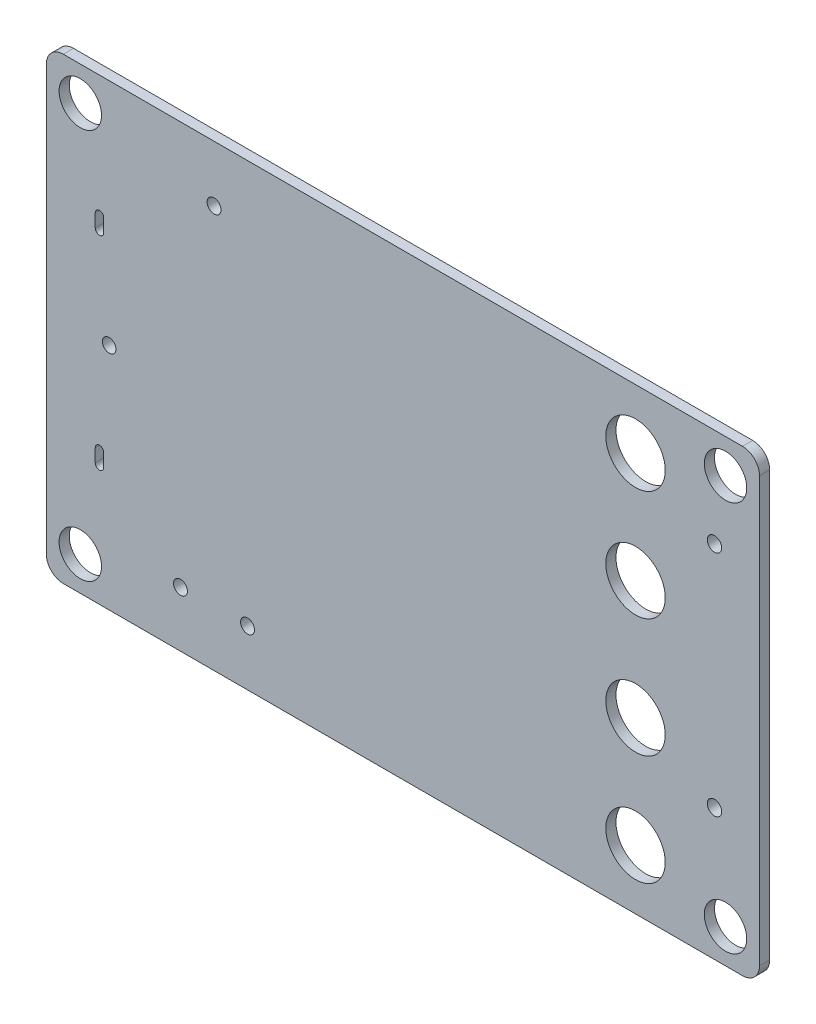
from build123d import *

# Parameters (mm, degrees)
SKETCH1_W           = 106.68
SKETCH1_H           = 68.58
BOSS_EXTRUDE1_DEPTH = 1.524
CUT_EXTRUDE1_REACH  = 65.429
SKETCH2_R           = 3.175
CUT_EXTRUDE2_REACH  = 65.429
SKETCH3_R           = 4.445
FILLET1_R           = 2.54
CUT_EXTRUDE3_REACH  = 65.429
SKETCH4_R           = 1.0414
SKETCH4_R_2         = 1.0795
CUT_EXTRUDE4_REACH  = 65.429
SKETCH5_R           = 1.016
CUT_EXTRUDE5_REACH  = 65.429


with BuildPart() as part:
    # Sketch1 → Boss-Extrude1 (new body)
    with BuildSketch(Plane.XY):
        Rectangle(SKETCH1_W, SKETCH1_H)
    extrude(amount=BOSS_EXTRUDE1_DEPTH)

    # Sketch2 → Cut-Extrude1 (cut, up to next)
    with BuildSketch(Plane.XY.offset(1.524), mode=Mode.PRIVATE) as cut_extrude1_sk1:
        with Locations((-48.26, 29.21)):
            Circle(SKETCH2_R)
    cut_extrude1_tool1 = extrude(cut_extrude1_sk1.sketch, amount=-CUT_EXTRUDE1_REACH, mode=Mode.PRIVATE) & part.part
    # Sketch2 → Cut-Extrude1 (cut, up to next)
    with BuildSketch(Plane.XY.offset(1.524), mode=Mode.PRIVATE) as cut_extrude1_sk2:
        with Locations((-48.26, -29.21)):
            Circle(SKETCH2_R)
    cut_extrude1_tool2 = extrude(cut_extrude1_sk2.sketch, amount=-CUT_EXTRUDE1_REACH, mode=Mode.PRIVATE) & part.part
    # Sketch2 → Cut-Extrude1 (cut, up to next)
    with BuildSketch(Plane.XY.offset(1.524), mode=Mode.PRIVATE) as cut_extrude1_sk3:
        with Locations((48.26, -29.21)):
            Circle(SKETCH2_R)
    cut_extrude1_tool3 = extrude(cut_extrude1_sk3.sketch, amount=-CUT_EXTRUDE1_REACH, mode=Mode.PRIVATE) & part.part
    # Sketch2 → Cut-Extrude1 (cut, up to next)
    with BuildSketch(Plane.XY.offset(1.524), mode=Mode.PRIVATE) as cut_extrude1_sk4:
        with Locations((48.26, 29.21)):
            Circle(SKETCH2_R)
    cut_extrude1_tool4 = extrude(cut_extrude1_sk4.sketch, amount=-CUT_EXTRUDE1_REACH, mode=Mode.PRIVATE) & part.part
    add(cut_extrude1_tool1.solids().sort_by_distance((-48.26, 29.21, 1.524))[0], mode=Mode.SUBTRACT)
    add(cut_extrude1_tool2.solids().sort_by_distance((-48.26, -29.21, 1.524))[0], mode=Mode.SUBTRACT)
    add(cut_extrude1_tool3.solids().sort_by_distance((48.26, -29.21, 1.524))[0], mode=Mode.SUBTRACT)
    add(cut_extrude1_tool4.solids().sort_by_distance((48.26, 29.21, 1.524))[0], mode=Mode.SUBTRACT)

    # Sketch3 → Cut-Extrude2 (cut, up to next)
    with BuildSketch(Plane.XY.offset(1.524), mode=Mode.PRIVATE) as cut_extrude2_sk1:
        with Locations((34.798, -25.4)):
            Circle(SKETCH3_R)
    cut_extrude2_tool1 = extrude(cut_extrude2_sk1.sketch, amount=-CUT_EXTRUDE2_REACH, mode=Mode.PRIVATE) & part.part
    # Sketch3 → Cut-Extrude2 (cut, up to next)
    with BuildSketch(Plane.XY.offset(1.524), mode=Mode.PRIVATE) as cut_extrude2_sk2:
        with Locations((34.798, -8.89)):
            Circle(SKETCH3_R)
    cut_extrude2_tool2 = extrude(cut_extrude2_sk2.sketch, amount=-CUT_EXTRUDE2_REACH, mode=Mode.PRIVATE) & part.part
    # Sketch3 → Cut-Extrude2 (cut, up to next)
    with BuildSketch(Plane.XY.offset(1.524), mode=Mode.PRIVATE) as cut_extrude2_sk3:
        with Locations((34.798, 8.89)):
            Circle(SKETCH3_R)
    cut_extrude2_tool3 = extrude(cut_extrude2_sk3.sketch, amount=-CUT_EXTRUDE2_REACH, mode=Mode.PRIVATE) & part.part
    # Sketch3 → Cut-Extrude2 (cut, up to next)
    with BuildSketch(Plane.XY.offset(1.524), mode=Mode.PRIVATE) as cut_extrude2_sk4:
        with Locations((34.798, 25.4)):
            Circle(SKETCH3_R)
    cut_extrude2_tool4 = extrude(cut_extrude2_sk4.sketch, amount=-CUT_EXTRUDE2_REACH, mode=Mode.PRIVATE) & part.part
    add(cut_extrude2_tool1.solids().sort_by_distance((34.798, -25.4, 1.524))[0], mode=Mode.SUBTRACT)
    add(cut_extrude2_tool2.solids().sort_by_distance((34.798, -8.89, 1.524))[0], mode=Mode.SUBTRACT)
    add(cut_extrude2_tool3.solids().sort_by_distance((34.798, 8.89, 1.524))[0], mode=Mode.SUBTRACT)
    add(cut_extrude2_tool4.solids().sort_by_distance((34.798, 25.4, 1.524))[0], mode=Mode.SUBTRACT)

    # Fillet1
    fillet1_edges = [part.edges().sort_by_distance(p)[0] for p in [
        (53.34, -34.29, 0.762),
        (-53.34, -34.29, 0.762),
        (-53.34, 34.29, 0.762),
        (53.34, 34.29, 0.762),
    ]]
    fillet(fillet1_edges, radius=FILLET1_R)

    # Sketch4 → Cut-Extrude3 (cut, up to next)
    with BuildSketch(Plane.XY.offset(1.524), mode=Mode.PRIVATE) as cut_extrude3_sk1:
        with Locations((-23.241, -26.0096)):
            Circle(SKETCH4_R)
    cut_extrude3_tool1 = extrude(cut_extrude3_sk1.sketch, amount=-CUT_EXTRUDE3_REACH, mode=Mode.PRIVATE) & part.part
    # Sketch4 → Cut-Extrude3 (cut, up to next)
    with BuildSketch(Plane.XY.offset(1.524), mode=Mode.PRIVATE) as cut_extrude3_sk2:
        with Locations((-33.274, -26.0096)):
            Circle(SKETCH4_R)
    cut_extrude3_tool2 = extrude(cut_extrude3_sk2.sketch, amount=-CUT_EXTRUDE3_REACH, mode=Mode.PRIVATE) & part.part
    # Sketch4 → Cut-Extrude3 (cut, up to next)
    with BuildSketch(Plane.XY.offset(1.524), mode=Mode.PRIVATE) as cut_extrude3_sk3:
        with Locations((-28.2448, 25.908)):
            Circle(SKETCH4_R)
    cut_extrude3_tool3 = extrude(cut_extrude3_sk3.sketch, amount=-CUT_EXTRUDE3_REACH, mode=Mode.PRIVATE) & part.part
    # Sketch4 → Cut-Extrude3 (cut, up to next)
    with BuildSketch(Plane.XY.offset(1.524), mode=Mode.PRIVATE) as cut_extrude3_sk4:
        with Locations((46.609, 19.558)):
            Circle(SKETCH4_R_2)
    cut_extrude3_tool4 = extrude(cut_extrude3_sk4.sketch, amount=-CUT_EXTRUDE3_REACH, mode=Mode.PRIVATE) & part.part
    # Sketch4 → Cut-Extrude3 (cut, up to next)
    with BuildSketch(Plane.XY.offset(1.524), mode=Mode.PRIVATE) as cut_extrude3_sk5:
        with Locations((46.609, -14.605)):
            Circle(SKETCH4_R_2)
    cut_extrude3_tool5 = extrude(cut_extrude3_sk5.sketch, amount=-CUT_EXTRUDE3_REACH, mode=Mode.PRIVATE) & part.part
    add(cut_extrude3_tool1.solids().sort_by_distance((-23.241, -26.0096, 1.524))[0], mode=Mode.SUBTRACT)
    add(cut_extrude3_tool2.solids().sort_by_distance((-33.274, -26.0096, 1.524))[0], mode=Mode.SUBTRACT)
    add(cut_extrude3_tool3.solids().sort_by_distance((-28.2448, 25.908, 1.524))[0], mode=Mode.SUBTRACT)
    add(cut_extrude3_tool4.solids().sort_by_distance((46.609, 19.558, 1.524))[0], mode=Mode.SUBTRACT)
    add(cut_extrude3_tool5.solids().sort_by_distance((46.609, -14.605, 1.524))[0], mode=Mode.SUBTRACT)

    # Sketch5 → Cut-Extrude4 (cut, up to next)
    with BuildSketch(Plane.XY.offset(1.524), mode=Mode.PRIVATE) as cut_extrude4_sk1:
        with Locations((-43.942, 0)):
            Circle(SKETCH5_R)
    cut_extrude4_tool1 = extrude(cut_extrude4_sk1.sketch, amount=-CUT_EXTRUDE4_REACH, mode=Mode.PRIVATE) & part.part
    add(cut_extrude4_tool1.solids().sort_by_distance((-43.942, 0, 1.524))[0], mode=Mode.SUBTRACT)

    # Sketch6 → Cut-Extrude5 (cut, up to next)
    with BuildSketch(Plane.XY.offset(1.524), mode=Mode.PRIVATE) as cut_extrude5_sk1:
        with BuildLine():
            Line((-44.7548, 16.129), (-44.7548, 14.1732))
            ThreePointArc((-44.7548, 14.1732), (-45.3898, 13.5382), (-46.0248, 14.1732))
            Line((-46.0248, 14.1732), (-46.0248, 16.129))
            ThreePointArc((-46.0248, 16.129), (-45.3898, 16.764), (-44.7548, 16.129))
        make_face()
    cut_extrude5_tool1 = extrude(cut_extrude5_sk1.sketch, amount=-CUT_EXTRUDE5_REACH, mode=Mode.PRIVATE) & part.part
    # Sketch6 → Cut-Extrude5 (cut, up to next)
    with BuildSketch(Plane.XY.offset(1.524), mode=Mode.PRIVATE) as cut_extrude5_sk2:
        with BuildLine():
            Line((-44.7548, -14.3002), (-44.7548, -16.256))
            ThreePointArc((-44.7548, -16.256), (-45.3898, -16.891), (-46.0248, -16.256))
            Line((-46.0248, -16.256), (-46.0248, -14.3002))
            ThreePointArc((-46.0248, -14.3002), (-45.3898, -13.6652), (-44.7548, -14.3002))
        make_face()
    cut_extrude5_tool2 = extrude(cut_extrude5_sk2.sketch, amount=-CUT_EXTRUDE5_REACH, mode=Mode.PRIVATE) & part.part
    add(cut_extrude5_tool1.solids().sort_by_distance((-45.3898, 15.1511, 1.524))[0], mode=Mode.SUBTRACT)
    add(cut_extrude5_tool2.solids().sort_by_distance((-45.3898, -15.2781, 1.524))[0], mode=Mode.SUBTRACT)


solid = part.part
